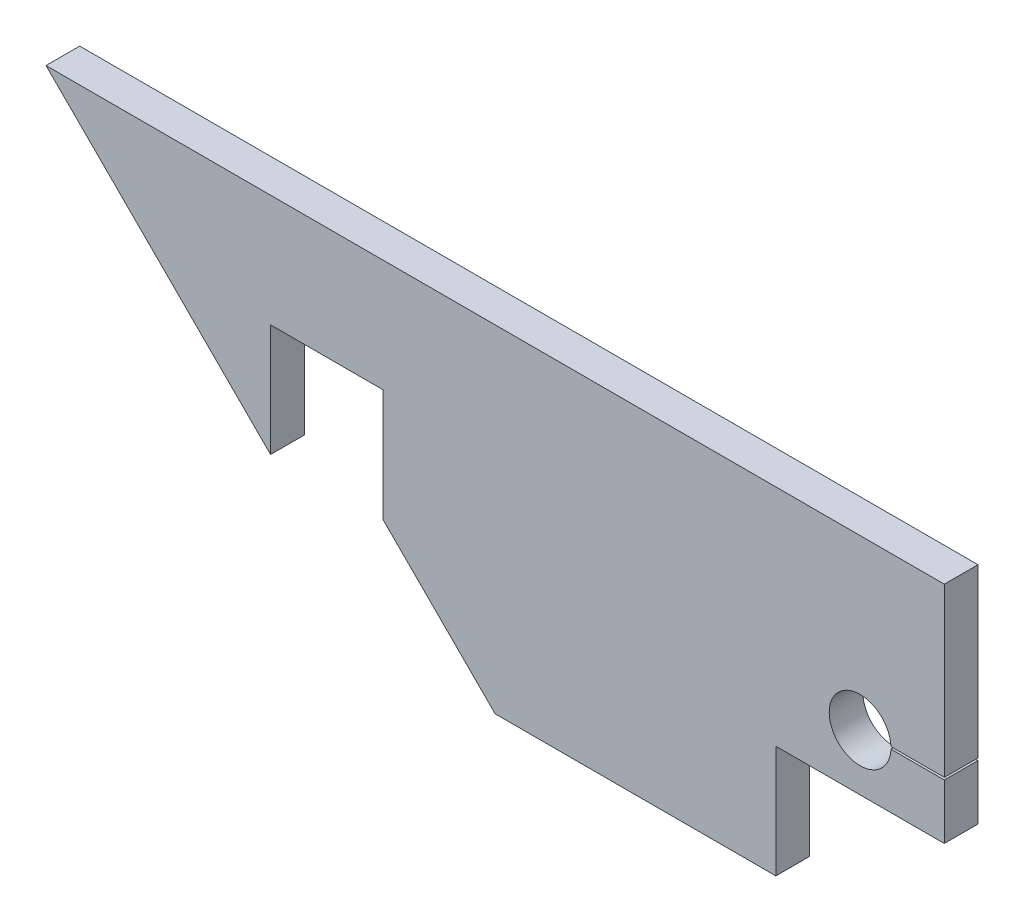
from build123d import *

# Parameters (mm, degrees)
ESBO_O1_W                = 80
ESBO_O1_H                = 30
RESSALTO_EXTRUS_O1_DEPTH = 3
ESBO_O3_W                = 15
ESBO_O3_H                = 10
CORTE_EXTRUS_O1_DEPTH    = 43.825226211
FURO_COM_FOLGA_DE_M51_D  = 5.5
ESBO_O6_W                = 7.5
ESBO_O6_H                = 0.2
CORTE_EXTRUS_O2_DEPTH    = 10


with BuildPart() as part:
    # Esboço1 → Ressalto-extrusão1 (new body)
    with BuildSketch(Plane.XY):
        Rectangle(ESBO_O1_W, ESBO_O1_H)
    extrude(amount=RESSALTO_EXTRUS_O1_DEPTH)

    # Esboço3 → Corte-extrusão1 (cut, through all)
    with BuildSketch(Plane.XY.offset(3)):
        Polygon((-40, 15), (-40, -15), (0, -15), (-10, -5), (-10, 5), (-20, 5), (-20, -5), align=None)
        with Locations((32.5, -10)):
            Rectangle(ESBO_O3_W, ESBO_O3_H)
    extrude(amount=-CORTE_EXTRUS_O1_DEPTH, mode=Mode.SUBTRACT)

    # Furo com folga de M51 (through all)
    with Locations(Plane.XY.offset(3)):
        with Locations((32.5, 0)):
            Hole(FURO_COM_FOLGA_DE_M51_D / 2)

    # Esboço6 → Corte-extrusão2 (cut)
    with BuildSketch(Plane.XY.offset(3)):
        with Locations((36.25, 0)):
            Rectangle(ESBO_O6_W, ESBO_O6_H)
    extrude(amount=-CORTE_EXTRUS_O2_DEPTH, mode=Mode.SUBTRACT)


solid = part.part
